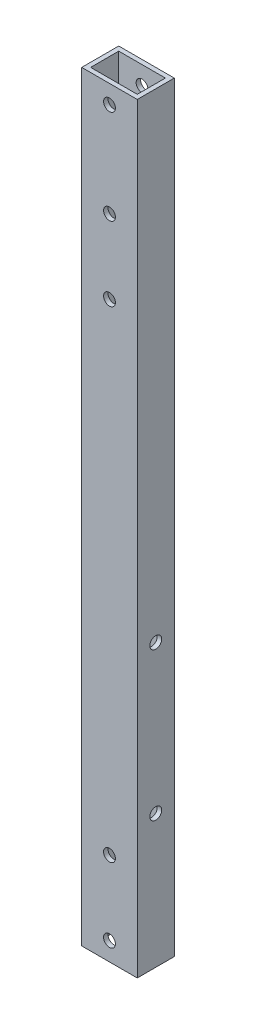
from build123d import *

# Parameters (mm, degrees)
SKETCH_1_W          = 15
SKETCH_1_H          = 10
SKETCH_1_W_2        = 12.6
SKETCH_1_H_2        = 7.6
EXTRUDE_1_DEPTH     = 110
SKETCH_2_R          = 1.6
CUT_EXTRUDE_1_DEPTH = 100
SKETCH_3_R          = 1.6
CUT_EXTRUDE_2_DEPTH = 15
SKETCH_4_R          = 1.6
CUT_EXTRUDE_3_DEPTH = 10
SKETCH_5_W          = 15
SKETCH_5_H          = 10
CUT_EXTRUDE_4_DEPTH = 14.5
SKETCH_6_R          = 1.6
CUT_EXTRUDE_5_DEPTH = 15


with BuildPart() as part:
    # ｽｹｯﾁ1 → ﾎﾞｽ - 押し出し1 (new, symmetric)
    with BuildSketch(Plane(origin=(0, 0, 0), x_dir=(1, 0, 0), z_dir=(0, 1, 0))):
        Rectangle(SKETCH_1_W, SKETCH_1_H)
        Rectangle(SKETCH_1_W_2, SKETCH_1_H_2, mode=Mode.SUBTRACT)
    extrude(amount=EXTRUDE_1_DEPTH, both=True)

    # ｽｹｯﾁ2 → ｶｯﾄ - 押し出し1 (cut)
    with BuildSketch(Plane(origin=(0, 0, -5), x_dir=(-1, 0, 0), z_dir=(0, 0, -1))):
        with Locations((0, -85)):
            Circle(SKETCH_2_R)
        with Locations((0, -105)):
            Circle(SKETCH_2_R)
    extrude(amount=-CUT_EXTRUDE_1_DEPTH, mode=Mode.SUBTRACT)

    # ｽｹｯﾁ3 → ｶｯﾄ - 押し出し2 (cut)
    with BuildSketch(Plane.ZY.offset(7.5)):
        with Locations((0, -74)):
            Circle(SKETCH_3_R)
        with Locations((0, -34)):
            Circle(SKETCH_3_R)
    extrude(amount=-CUT_EXTRUDE_2_DEPTH, mode=Mode.SUBTRACT)

    # ｽｹｯﾁ4 → ｶｯﾄ - 押し出し3 (cut)
    with BuildSketch(Plane(origin=(0, 0, -5), x_dir=(-1, 0, 0), z_dir=(0, 0, -1))):
        with Locations((0, 45)):
            Circle(SKETCH_4_R)
        with Locations((0, 65)):
            Circle(SKETCH_4_R)
    extrude(amount=-CUT_EXTRUDE_3_DEPTH, mode=Mode.SUBTRACT)

    # ｽｹｯﾁ5 → ｶｯﾄ - 押し出し4 (cut)
    with BuildSketch(Plane(origin=(0, 110, 0), x_dir=(1, 0, 0), z_dir=(0, 1, 0))):
        Rectangle(SKETCH_5_W, SKETCH_5_H)
    extrude(amount=-CUT_EXTRUDE_4_DEPTH, mode=Mode.SUBTRACT)

    # ｽｹｯﾁ6 → ｶｯﾄ - 押し出し5 (cut)
    with BuildSketch(Plane(origin=(0, 0, -5), x_dir=(-1, 0, 0), z_dir=(0, 0, -1))):
        with Locations((0, 90.5)):
            Circle(SKETCH_6_R)
    extrude(amount=-CUT_EXTRUDE_5_DEPTH, mode=Mode.SUBTRACT)


solid = part.part
